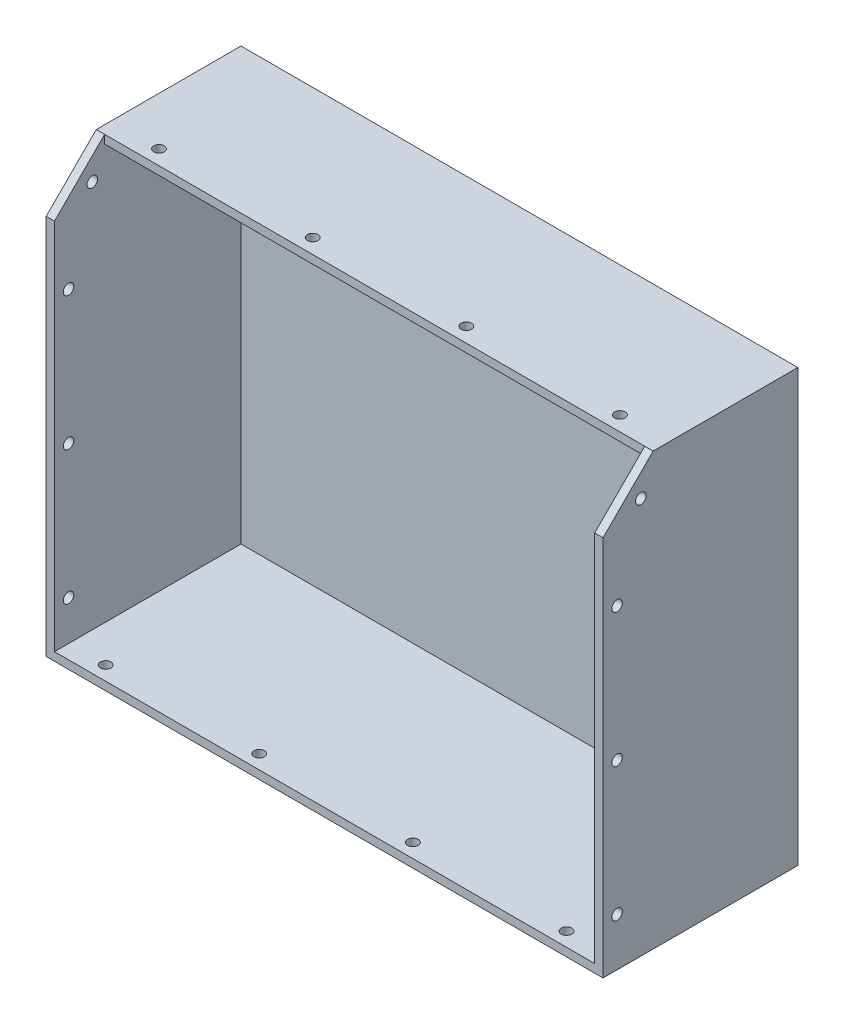
from build123d import *

# Parameters (mm, degrees)
SKETCH2_W                = 211.751333334
SKETCH2_H                = 164
BOSS_EXTRUDE1_DEPTH      = 74.083333333
CUT_EXTRUDE7_DEPTH       = 70.90833333
CUT_EXTRUDE9_REACH       = 240.853
CUT_EXTRUDE10_DEPTH      = 3.175
SKETCH14_W               = 205.401333334
SKETCH14_H               = 3.175
CUT_EXTRUDE11_DEPTH      = 3.175
CUT_EXTRUDE12_DEPTH      = 239.853443446
CUT_EXTRUDE12_DEPTH_BACK = 3.175
SKETCH16_R               = 2
CUT_EXTRUDE13_DEPTH      = 239.853443446
LPATTERN1_COUNT          = 3
LPATTERN1_PITCH          = 50.8
CUT_EXTRUDE14_REACH      = 210.792
SKETCH18_R               = 2
LPATTERN2_COUNT          = 4
LPATTERN2_PITCH          = 58.42
CUT_EXTRUDE15_REACH      = 210.792
SKETCH19_R               = 2
LPATTERN3_COUNT          = 4
LPATTERN3_PITCH          = 58.42
SKETCH20_R               = 2
CUT_EXTRUDE16_DEPTH      = 239.853443446


with BuildPart() as part:
    # Sketch2 → Boss-Extrude1 (new body)
    with BuildSketch(Plane.XY):
        Rectangle(SKETCH2_W, SKETCH2_H)
    extrude(amount=BOSS_EXTRUDE1_DEPTH)

    # Sketch9 → Cut-Extrude7 (cut)
    with BuildSketch(Plane.XY.offset(74.083333333)):
        Polygon((-102.700666667, 62.95), (-102.700666667, -47.748173381), (-102.700666667, -78.825), (-61.266487403, -78.825), (102.700666667, -78.825), (102.700666667, -21.962957065), (102.700666667, 78.825), (-87.76182231, 78.825), (-102.700666667, 78.825), align=None)
    extrude(amount=-CUT_EXTRUDE7_DEPTH, mode=Mode.SUBTRACT)

    # Sketch11 → Cut-Extrude9 (cut, up to next)
    with BuildSketch(Plane.ZY.offset(105.875666667), mode=Mode.PRIVATE) as cut_extrude9_sk1:
        Polygon((58.208333333, 78.825), (74.083333333, 62.95), (74.083333333, 82), (58.208333333, 82), (58.208333333, 79.62382388), align=None)
    cut_extrude9_tool1 = extrude(cut_extrude9_sk1.sketch, amount=-CUT_EXTRUDE9_REACH, mode=Mode.PRIVATE) & part.part
    add(cut_extrude9_tool1.solids().sort_by_distance((-105.875667, 75.49881, 68.035714))[0], mode=Mode.SUBTRACT)

    # Sketch13 → Cut-Extrude10 (cut)
    with BuildSketch(Plane.ZY.offset(105.875666667)):
        Polygon((58.208333333, 78.825), (55.033333333, 82), (58.208333333, 82), align=None)
    extrude(amount=-CUT_EXTRUDE10_DEPTH, mode=Mode.SUBTRACT)

    # Sketch14 → Cut-Extrude11 (cut)
    with BuildSketch(Plane.XY.offset(58.208333333)):
        with Locations((0, 80.4125)):
            Rectangle(SKETCH14_W, SKETCH14_H)
    extrude(amount=-CUT_EXTRUDE11_DEPTH, mode=Mode.SUBTRACT)

    # Sketch15 → Cut-Extrude12 (cut, two sides: drawn at the far end of the back side and taken through both)
    with BuildSketch(Plane(origin=(105.875666667, 0, 0), x_dir=(0, 0, -1), z_dir=(1, 0, 0)).offset(-CUT_EXTRUDE12_DEPTH_BACK)):
        Polygon((-58.208333333, 79.215720039), (-58.208333333, 78.825), (-55.033333333, 82), (-58.208333333, 82), align=None)
    extrude(amount=CUT_EXTRUDE12_DEPTH + CUT_EXTRUDE12_DEPTH_BACK, mode=Mode.SUBTRACT)

    # Sketch16 → Cut-Extrude13 (cut, through all)
    with BuildSketch(Plane.ZY.offset(105.875666667)):
        with Locations((68.749333333, -63.712)):
            Circle(SKETCH16_R)
    cut_extrude13 = extrude(amount=-CUT_EXTRUDE13_DEPTH, mode=Mode.SUBTRACT)

    # LPattern1: Cut-Extrude13 ×3
    with Locations(*[(0, i * LPATTERN1_PITCH, 0) for i in range(1, LPATTERN1_COUNT)]):
        add(cut_extrude13, mode=Mode.SUBTRACT)

    # Sketch18 → Cut-Extrude14 (cut, up to next)
    with BuildSketch(Plane.XZ.offset(82), mode=Mode.PRIVATE) as cut_extrude14_sk1:
        with Locations(Location((-88.603666667, 68.749333333, 0), (0, 0, 270))):
            Circle(SKETCH18_R)
    cut_extrude14_tool1 = extrude(cut_extrude14_sk1.sketch, amount=-CUT_EXTRUDE14_REACH, mode=Mode.PRIVATE) & part.part
    cut_extrude14 = cut_extrude14_tool1.solids().sort_by_distance((-88.603667, -82, 68.749333))[0]
    add(cut_extrude14, mode=Mode.SUBTRACT)

    # LPattern2: Cut-Extrude14 ×4
    with Locations(*[(i * LPATTERN2_PITCH, 0, 0) for i in range(1, LPATTERN2_COUNT)]):
        add(cut_extrude14, mode=Mode.SUBTRACT)

    # Sketch19 → Cut-Extrude15 (cut, up to next)
    with BuildSketch(Plane(origin=(0, 82, 0), x_dir=(1, 0, 0), z_dir=(0, 1, 0)), mode=Mode.PRIVATE) as cut_extrude15_sk1:
        with Locations(Location((-87.587666667, -49.445333333, 0), (0, 0, 270))):
            Circle(SKETCH19_R)
    cut_extrude15_tool1 = extrude(cut_extrude15_sk1.sketch, amount=-CUT_EXTRUDE15_REACH, mode=Mode.PRIVATE) & part.part
    cut_extrude15 = cut_extrude15_tool1.solids().sort_by_distance((-87.587667, 82, 49.445333))[0]
    add(cut_extrude15, mode=Mode.SUBTRACT)

    # LPattern3: Cut-Extrude15 ×4
    with Locations(*[(i * LPATTERN3_PITCH, 0, 0) for i in range(1, LPATTERN3_COUNT)]):
        add(cut_extrude15, mode=Mode.SUBTRACT)

    # Sketch20 → Cut-Extrude16 (cut, through all)
    with BuildSketch(Plane.ZY.offset(105.875666667)):
        with Locations((59.703066516, 68.709220941)):
            Circle(SKETCH20_R)
    extrude(amount=-CUT_EXTRUDE16_DEPTH, mode=Mode.SUBTRACT)


solid = part.part
